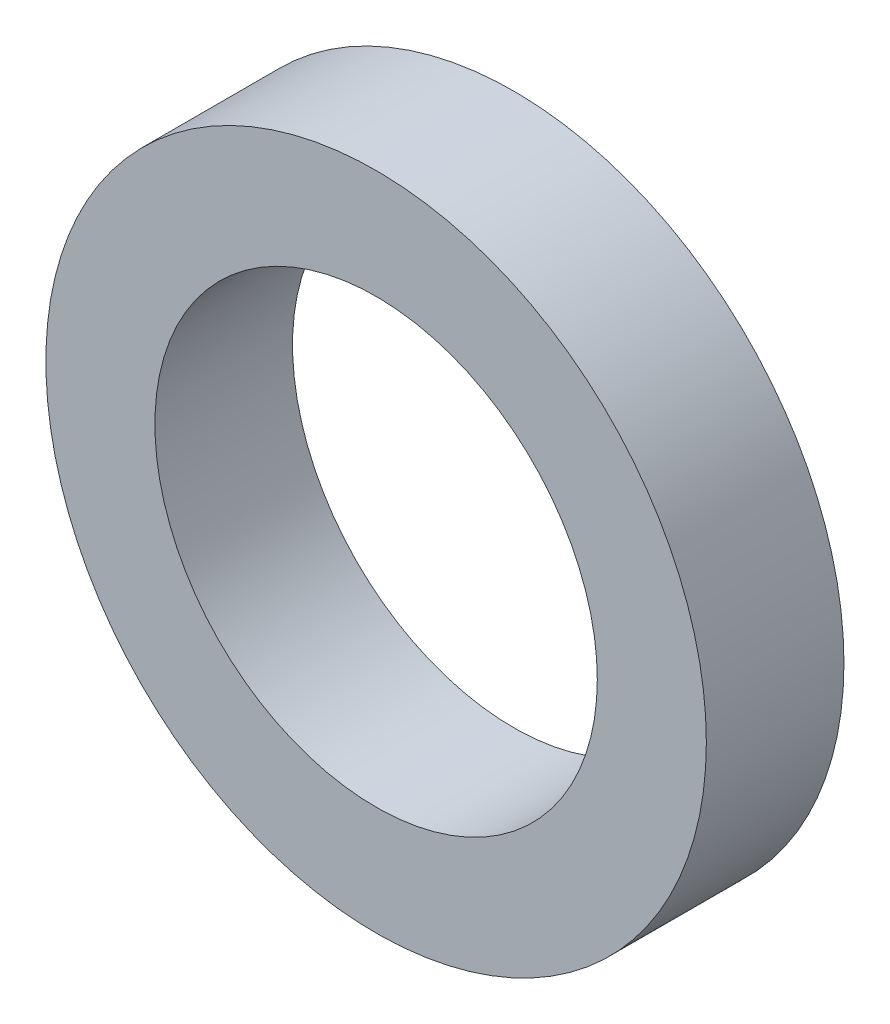
from build123d import *

# Parameters (mm, degrees)
EXTRUDE_SKETCH_1_R   = 48
EXTRUDE_SKETCH_1_R_2 = 32.15
EXTRUDE_1_DEPTH      = 20


with BuildPart() as part:
    # Extrude sketch 1 → Extrude 1 (new body)
    with BuildSketch(Plane.XY):
        Circle(EXTRUDE_SKETCH_1_R)
        Circle(EXTRUDE_SKETCH_1_R_2, mode=Mode.SUBTRACT)
    extrude(amount=EXTRUDE_1_DEPTH)


solid = part.part
